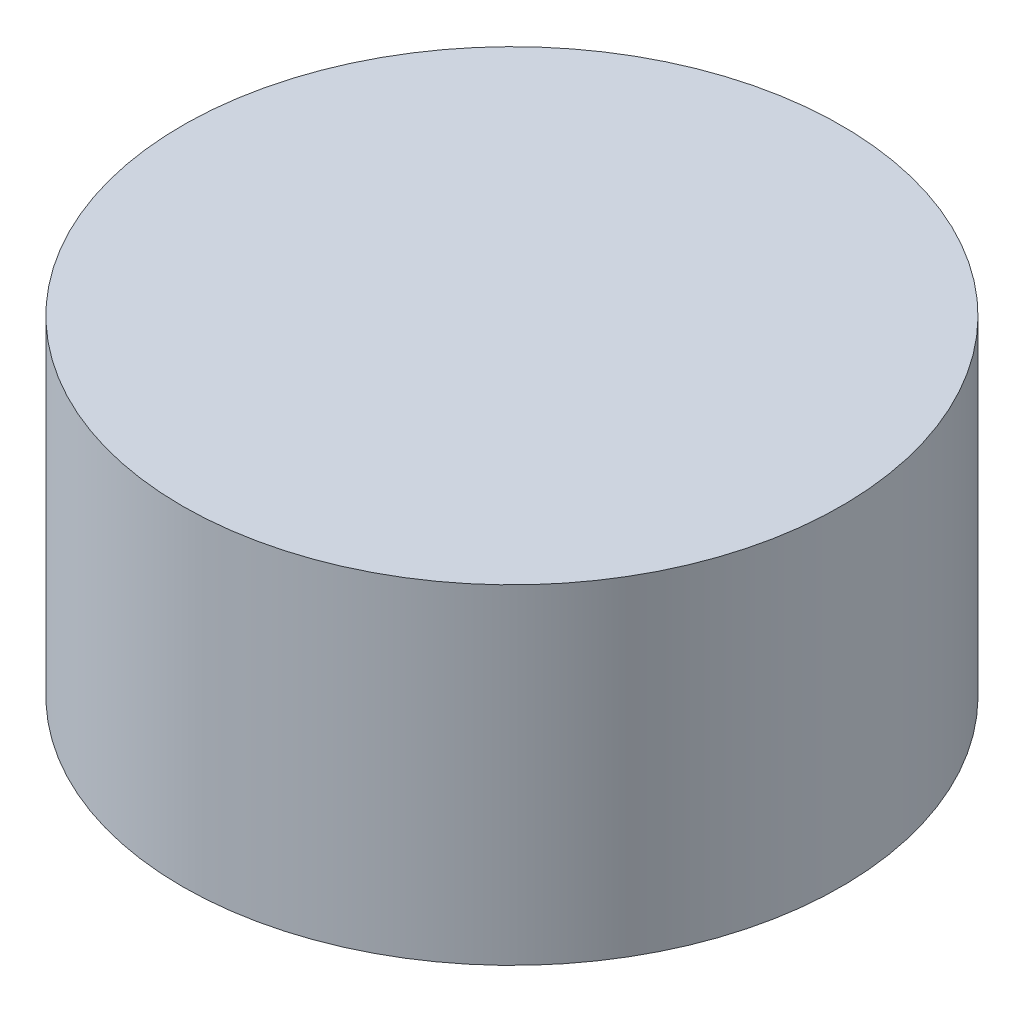
from build123d import *

# Parameters (mm, degrees)
SKETCH1_R           = 2
BOSS_EXTRUDE1_DEPTH = 2


with BuildPart() as part:
    # Sketch1 → Boss-Extrude1 (new body)
    with BuildSketch(Plane(origin=(0, 0, 0), x_dir=(1, 0, 0), z_dir=(0, 1, 0))):
        with Locations(Location((0, 0, 0), (0, 0, 270))):
            Circle(SKETCH1_R)
    extrude(amount=BOSS_EXTRUDE1_DEPTH)


solid = part.part
